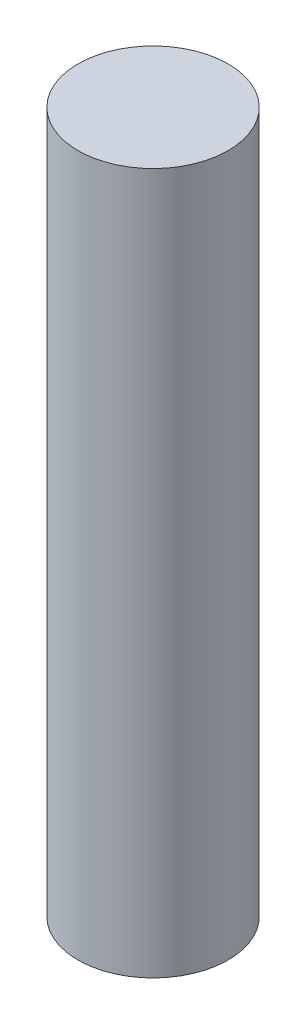
from build123d import *

# Parameters (mm, degrees)
SKETCH1_W = 1.5
SKETCH1_H = 14


with BuildPart() as part:
    # Sketch1 → Revolve1 (revolve)
    with BuildSketch(Plane.XY):
        with Locations((-0.75, 7)):
            Rectangle(SKETCH1_W, SKETCH1_H)
    revolve(axis=Axis((0, 0, 0), (0, 1, 0)))


solid = part.part
